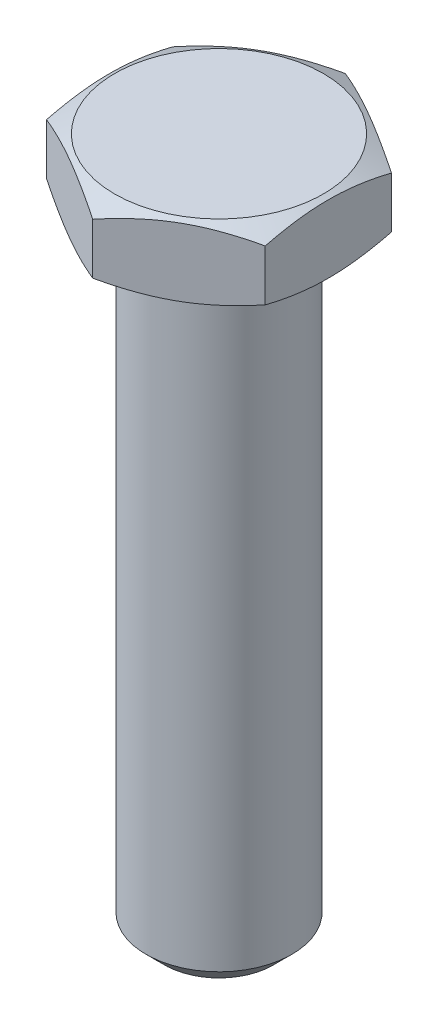
from build123d import *

# Parameters (mm, degrees)
BOSS_EXTRUDE1_DEPTH = 2
SKETCH2_R           = 2
BOSS_EXTRUDE2_DEPTH = 17
CHAMFER1_SIZE       = 0.5


with BuildPart() as part:
    # Sketch1 → Boss-Extrude1 (new body)
    with BuildSketch(Plane(origin=(0, 0, 0), x_dir=(1, 0, 0), z_dir=(0, 1, 0))):
        Polygon((0, -3.464101615), (3, -1.732050808), (3, 1.732050808), (0, 3.464101615), (-3, 1.732050808), (-3, -1.732050808), align=None)
    extrude(amount=BOSS_EXTRUDE1_DEPTH)

    # Sketch2 → Boss-Extrude2 (add)
    with BuildSketch(Plane.XZ):
        with Locations(Location((0, 0, 0), (0, 0, 270))):
            Circle(SKETCH2_R)
    extrude(amount=BOSS_EXTRUDE2_DEPTH)

    # Chamfer1
    chamfer1_edges = [part.edges().sort_by_distance(p)[0] for p in [
        (0, -17, 2),
    ]]
    chamfer(chamfer1_edges, length=CHAMFER1_SIZE)

    # Sketch4 → Cut-Revolve2 (revolve, cut)
    with BuildSketch(Plane(origin=(0, 0, 0), x_dir=(0, 0, -1), z_dir=(1, 0, 0)), mode=Mode.PRIVATE) as cut_revolve2_sk:
        Polygon((-2.864101615, 2), (-3.464101615, 1.7), (-3.464101615, 2), align=None)
        Polygon((-3.464101615, 0), (-2.864101615, 0), (-3.464101615, 0.3), align=None)
    revolve(cut_revolve2_sk.sketch.rotate(Axis((0, 2, 0), (0, 1, 0)), 180), axis=Axis((0, 2, 0), (0, 1, 0)), mode=Mode.SUBTRACT)


solid = part.part
